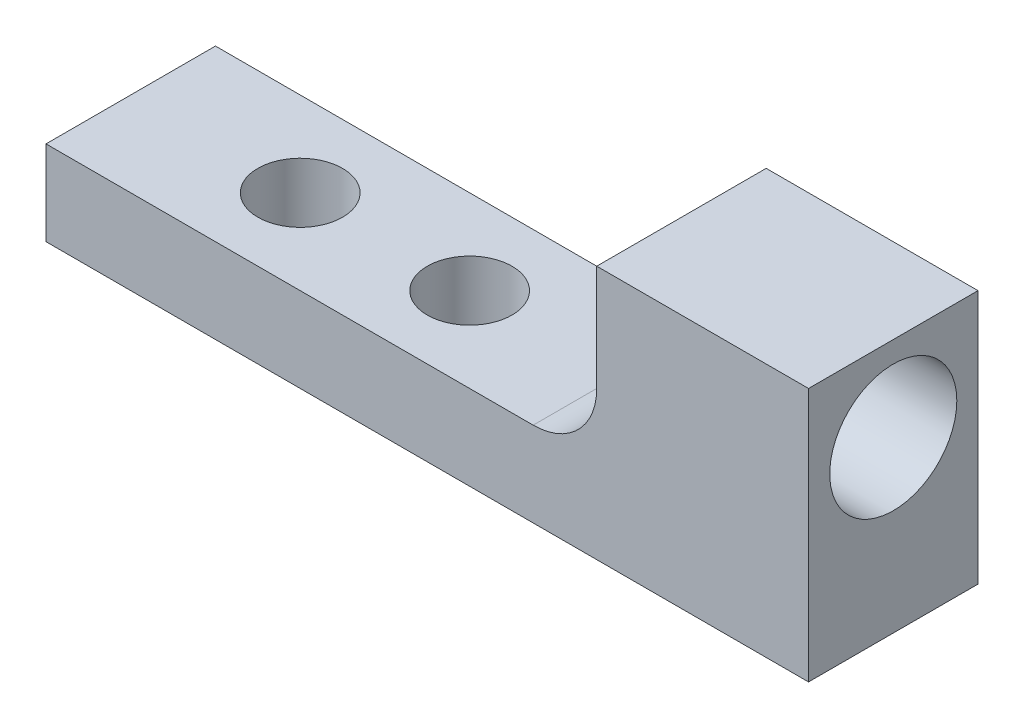
from build123d import *

# Parameters (mm, degrees)
SKETCH1_W           = 20.6375
SKETCH1_H           = 6.35
SKETCH1_R           = 1.5875
BOSS_EXTRUDE1_DEPTH = 3.175
SKETCH1_3_W         = 7.9375
SKETCH1_3_H         = 6.35
BOSS_EXTRUDE2_DEPTH = 9.525
FILLET1_R           = 2.38125
SKETCH2_R           = 2.38125
CUT_EXTRUDE1_DEPTH  = 31.287569645


with BuildPart() as part:
    # Sketch1 → Boss-Extrude1 (new body)
    with BuildSketch(Plane(origin=(0, 0, 0), x_dir=(1, 0, 0), z_dir=(0, 1, 0))):
        with Locations((-3.96875, 0)):
            Rectangle(SKETCH1_W, SKETCH1_H)
        with Locations((-7.9375, 0)):
            Circle(SKETCH1_R, mode=Mode.SUBTRACT)
        with Locations((-1.5875, 0)):
            Circle(SKETCH1_R, mode=Mode.SUBTRACT)
    extrude(amount=BOSS_EXTRUDE1_DEPTH)

    # Sketch1<3> → Boss-Extrude2 (add)
    with BuildSketch(Plane(origin=(0, 0, 0), x_dir=(1, 0, 0), z_dir=(0, 1, 0))):
        with Locations((10.31875, 0)):
            Rectangle(SKETCH1_3_W, SKETCH1_3_H)
    extrude(amount=BOSS_EXTRUDE2_DEPTH)

    # Fillet1
    fillet1_edges = [part.edges().sort_by_distance(p)[0] for p in [
        (6.35, 3.175, 0),
    ]]
    fillet(fillet1_edges, radius=FILLET1_R)

    # Sketch2 → Cut-Extrude1 (cut, through all)
    with BuildSketch(Plane(origin=(14.2875, 0, 0), x_dir=(0, 0, -1), z_dir=(1, 0, 0))):
        with Locations((0, 6.35)):
            Circle(SKETCH2_R)
    extrude(amount=-CUT_EXTRUDE1_DEPTH, mode=Mode.SUBTRACT)


solid = part.part
